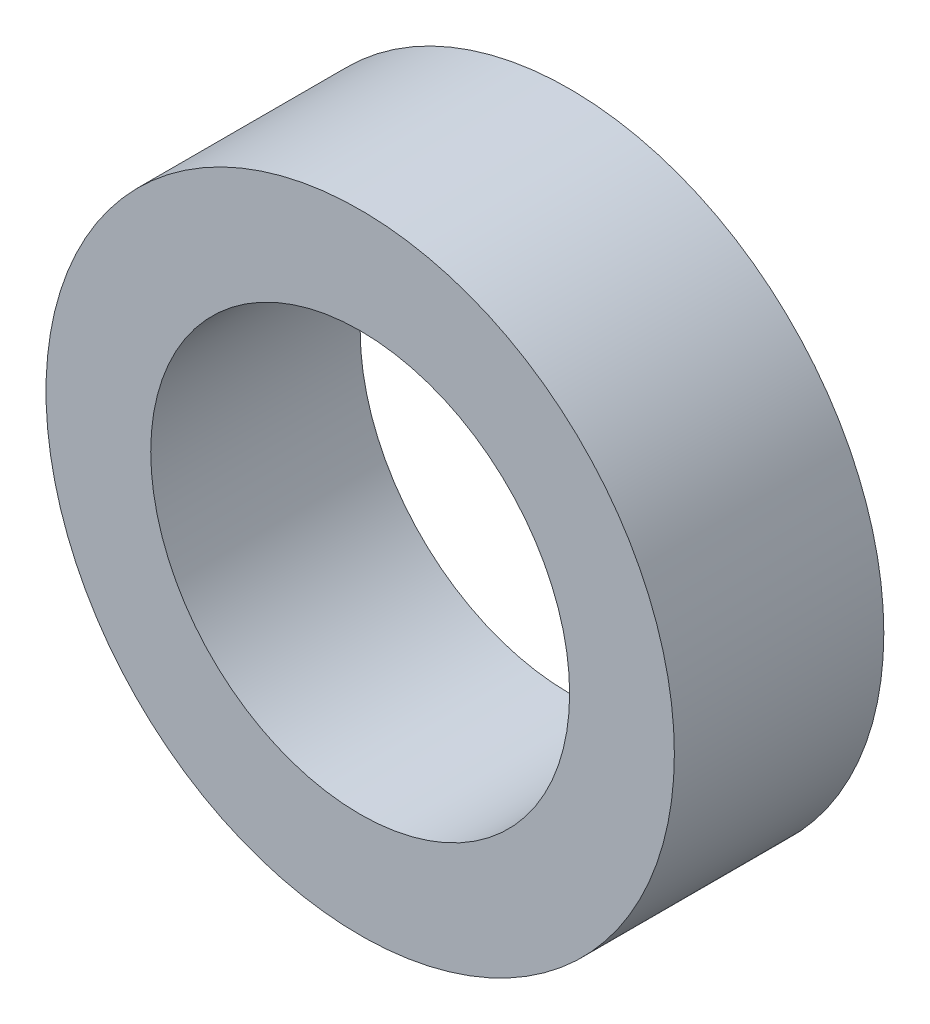
from build123d import *

# Parameters (mm, degrees)
SKETCH1_R           = 6
SKETCH1_R_2         = 4
EXTRUDE_THIN1_DEPTH = 4


with BuildPart() as part:
    # Sketch1 → Extrude-Thin1 (new body)
    with BuildSketch(Plane.XY):
        Circle(SKETCH1_R)
        Circle(SKETCH1_R_2, mode=Mode.SUBTRACT)
    extrude(amount=EXTRUDE_THIN1_DEPTH)


solid = part.part
